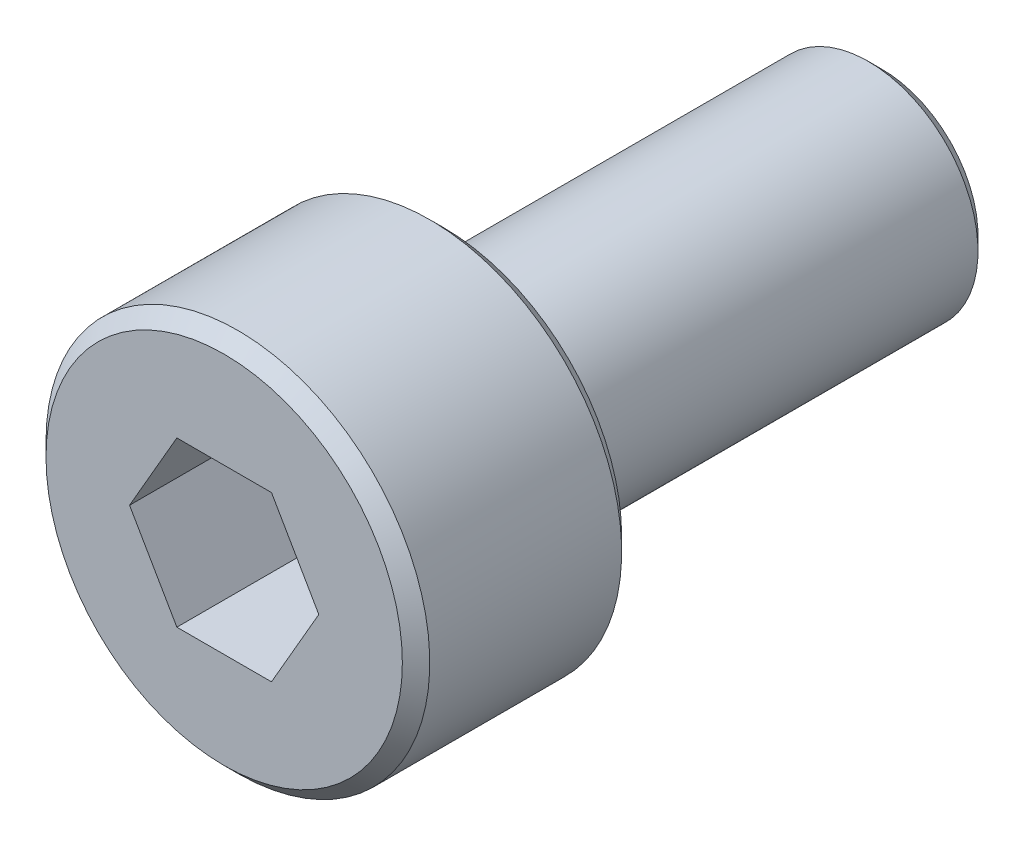
from build123d import *

# Parameters (mm, degrees)
SKETCH1_R           = 3.5
BOSS_EXTRUDE1_DEPTH = 4
SKETCH2_R           = 2
BOSS_EXTRUDE2_DEPTH = 8
CUT_EXTRUDE1_DEPTH  = 3
CHAMFER1_SIZE       = 0.25


with BuildPart() as part:
    # Sketch1 → Boss-Extrude1 (new body)
    with BuildSketch(Plane.XY.offset(4)):
        Circle(SKETCH1_R)
    extrude(amount=-BOSS_EXTRUDE1_DEPTH)

    # Sketch2 → Boss-Extrude2 (add)
    with BuildSketch(Plane(origin=(0, 0, 0), x_dir=(-1, 0, 0), z_dir=(0, 0, -1))):
        Circle(SKETCH2_R)
    extrude(amount=BOSS_EXTRUDE2_DEPTH)

    # Sketch3 → Cut-Extrude1 (cut)
    with BuildSketch(Plane.XY.offset(4)):
        Polygon((-1.726010921, 0), (-0.863005461, -1.494769305), (0.863005461, -1.494769305), (1.726010921, 0), (0.863005461, 1.494769305), (-0.863005461, 1.494769305), align=None)
    extrude(amount=-CUT_EXTRUDE1_DEPTH, mode=Mode.SUBTRACT)

    # Chamfer1
    chamfer1_edges = [part.edges().sort_by_distance(p)[0] for p in [
        (-3.5, 0, 4),
        (2, 0, -8),
        (-3.5, 0, 0),
    ]]
    chamfer(chamfer1_edges, length=CHAMFER1_SIZE)


solid = part.part
